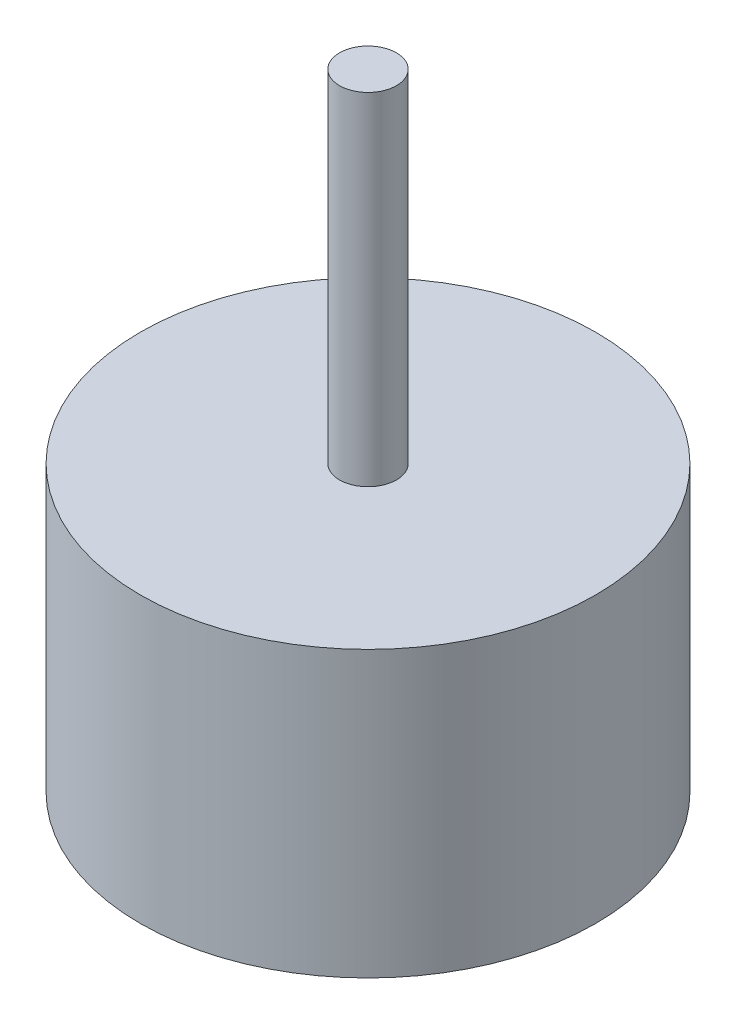
from build123d import *

# Parameters (mm, degrees)
SKETCH_1_R      = 20
EXTRUDE_1_DEPTH = 25
SKETCH_2_R      = 2.5
EXTRUDE_2_DEPTH = 30


with BuildPart() as part:
    # 草图1 → 凸台-拉伸1 (new body)
    with BuildSketch(Plane(origin=(0, 0, 0), x_dir=(1, 0, 0), z_dir=(0, 1, 0))):
        with Locations(Location((0, 0, 0), (0, 0, 270))):
            Circle(SKETCH_1_R)
    extrude(amount=EXTRUDE_1_DEPTH)

    # 草图2 → 凸台-拉伸2 (add)
    with BuildSketch(Plane(origin=(0, 25, 0), x_dir=(1, 0, 0), z_dir=(0, 1, 0))):
        with Locations(Location((0, 0, 0), (0, 0, 270))):
            Circle(SKETCH_2_R)
    extrude(amount=EXTRUDE_2_DEPTH)


solid = part.part
